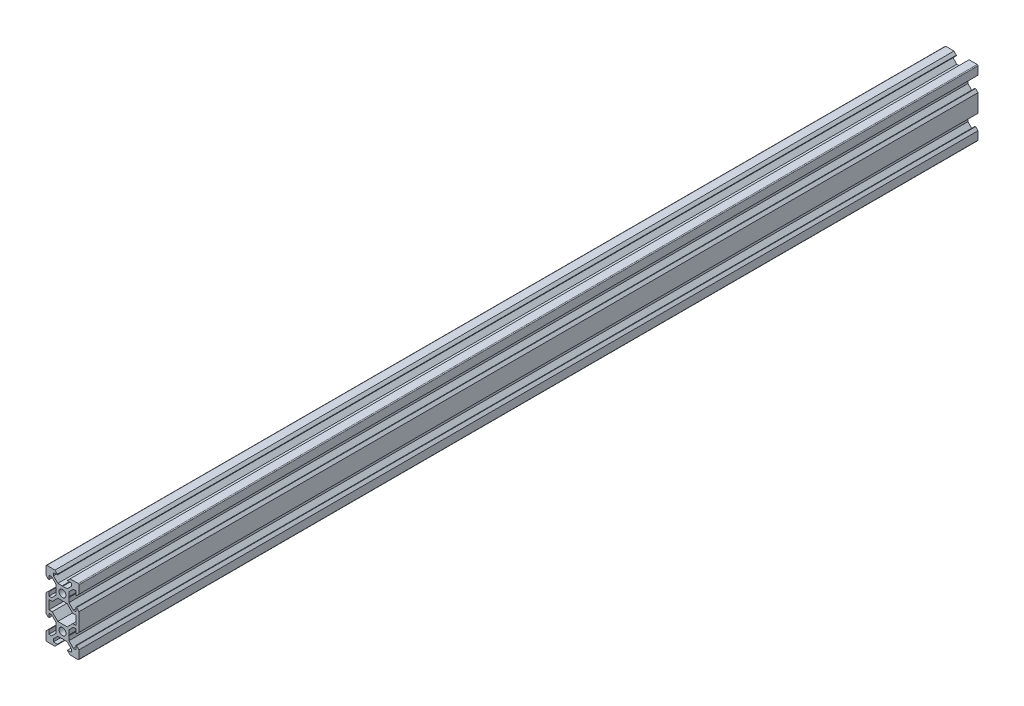
from build123d import *

# Parameters (mm, degrees)
SKETCH1_R           = 2.1
BOSS_EXTRUDE1_DEPTH = 545


with BuildPart() as part:
    # Sketch1 → Boss-Extrude1 (new body)
    with BuildSketch(Plane.XY):
        with BuildLine():
            Line((4.58, -20), (9.5, -20))
            ThreePointArc((9.5, -20), (9.853553391, -19.853553391), (10, -19.5))
            Line((10, -19.5), (10, -14.58))
            Line((10, -14.58), (8.545, -13.125))
            Line((8.545, -13.125), (8.2, -13.125))
            Line((8.2, -13.125), (8.2, -15.5))
            Line((8.2, -15.5), (6.560660172, -15.5))
            Line((6.560660172, -15.5), (3.9, -12.839339828))
            Line((3.9, -12.839339828), (3.9, -10.21))
            Line((3.9, -10.21), (3.69, -10))
            Line((3.69, -10), (3.9, -9.79))
            Line((3.9, -9.79), (3.9, -7.160660172))
            Line((3.9, -7.160660172), (6.560660172, -4.5))
            Line((6.560660172, -4.5), (8.2, -4.5))
            Line((8.2, -4.5), (8.2, -6.875))
            Line((8.2, -6.875), (8.545, -6.875))
            Line((8.545, -6.875), (10, -5.42))
            Line((10, -5.42), (10, 5.42))
            Line((10, 5.42), (8.545, 6.875))
            Line((8.545, 6.875), (8.2, 6.875))
            Line((8.2, 6.875), (8.2, 4.5))
            Line((8.2, 4.5), (6.560660172, 4.5))
            Line((6.560660172, 4.5), (3.9, 7.160660172))
            Line((3.9, 7.160660172), (3.9, 9.79))
            Line((3.9, 9.79), (3.69, 10))
            Line((3.69, 10), (3.9, 10.21))
            Line((3.9, 10.21), (3.9, 12.839339828))
            Line((3.9, 12.839339828), (6.560660172, 15.5))
            Line((6.560660172, 15.5), (8.2, 15.5))
            Line((8.2, 15.5), (8.2, 13.125))
            Line((8.2, 13.125), (8.545, 13.125))
            Line((8.545, 13.125), (10, 14.58))
            Line((10, 14.58), (10, 19.5))
            ThreePointArc((10, 19.5), (9.853553391, 19.853553391), (9.5, 20))
            Line((9.5, 20), (4.58, 20))
            Line((4.58, 20), (3.125, 18.545))
            Line((3.125, 18.545), (3.125, 18.2))
            Line((3.125, 18.2), (5.5, 18.2))
            Line((5.5, 18.2), (5.5, 16.560660172))
            Line((5.5, 16.560660172), (2.839339828, 13.9))
            Line((2.839339828, 13.9), (0.21, 13.9))
            Line((0.21, 13.9), (0, 13.69))
            Line((0, 13.69), (-0.21, 13.9))
            Line((-0.21, 13.9), (-2.839339828, 13.9))
            Line((-2.839339828, 13.9), (-5.5, 16.560660172))
            Line((-5.5, 16.560660172), (-5.5, 18.2))
            Line((-5.5, 18.2), (-3.125, 18.2))
            Line((-3.125, 18.2), (-3.125, 18.545))
            Line((-3.125, 18.545), (-4.58, 20))
            Line((-4.58, 20), (-9.5, 20))
            ThreePointArc((-9.5, 20), (-9.853553391, 19.853553391), (-10, 19.5))
            Line((-10, 19.5), (-10, 14.58))
            Line((-10, 14.58), (-8.545, 13.125))
            Line((-8.545, 13.125), (-8.2, 13.125))
            Line((-8.2, 13.125), (-8.2, 15.5))
            Line((-8.2, 15.5), (-6.560660172, 15.5))
            Line((-6.560660172, 15.5), (-3.9, 12.839339828))
            Line((-3.9, 12.839339828), (-3.9, 10.21))
            Line((-3.9, 10.21), (-3.69, 10))
            Line((-3.69, 10), (-3.9, 9.79))
            Line((-3.9, 9.79), (-3.9, 7.160660172))
            Line((-3.9, 7.160660172), (-6.560660172, 4.5))
            Line((-6.560660172, 4.5), (-8.2, 4.5))
            Line((-8.2, 4.5), (-8.2, 6.875))
            Line((-8.2, 6.875), (-8.545, 6.875))
            Line((-8.545, 6.875), (-10, 5.42))
            Line((-10, 5.42), (-10, -5.42))
            Line((-10, -5.42), (-8.545, -6.875))
            Line((-8.545, -6.875), (-8.2, -6.875))
            Line((-8.2, -6.875), (-8.2, -4.5))
            Line((-8.2, -4.5), (-6.560660172, -4.5))
            Line((-6.560660172, -4.5), (-3.9, -7.160660172))
            Line((-3.9, -7.160660172), (-3.9, -9.79))
            Line((-3.9, -9.79), (-3.69, -10))
            Line((-3.69, -10), (-3.9, -10.21))
            Line((-3.9, -10.21), (-3.9, -12.839339828))
            Line((-3.9, -12.839339828), (-6.560660172, -15.5))
            Line((-6.560660172, -15.5), (-8.2, -15.5))
            Line((-8.2, -15.5), (-8.2, -13.125))
            Line((-8.2, -13.125), (-8.545, -13.125))
            Line((-8.545, -13.125), (-10, -14.58))
            Line((-10, -14.58), (-10, -19.5))
            ThreePointArc((-10, -19.5), (-9.853553391, -19.853553391), (-9.5, -20))
            Line((-9.5, -20), (-4.58, -20))
            Line((-4.58, -20), (-3.125, -18.545))
            Line((-3.125, -18.545), (-3.125, -18.2))
            Line((-3.125, -18.2), (-5.5, -18.2))
            Line((-5.5, -18.2), (-5.5, -16.560660172))
            Line((-5.5, -16.560660172), (-2.839339828, -13.9))
            Line((-2.839339828, -13.9), (-0.21, -13.9))
            Line((-0.21, -13.9), (0, -13.69))
            Line((0, -13.69), (0.21, -13.9))
            Line((0.21, -13.9), (2.839339828, -13.9))
            Line((2.839339828, -13.9), (5.5, -16.560660172))
            Line((5.5, -16.560660172), (5.5, -18.2))
            Line((5.5, -18.2), (3.125, -18.2))
            Line((3.125, -18.2), (3.125, -18.545))
            Line((3.125, -18.545), (4.58, -20))
        make_face()
        with Locations((0, -10)):
            Circle(SKETCH1_R, mode=Mode.SUBTRACT)
        Polygon((-6.239339828, -2.7), (-8.2, -2.7), (-8.2, 2.7), (-6.239339828, 2.7), (-2.839339828, 6.1), (2.839339828, 6.1), (6.239339828, 2.7), (8.2, 2.7), (8.2, -2.7), (6.239339828, -2.7), (2.839339828, -6.1), (-2.839339828, -6.1), align=None, mode=Mode.SUBTRACT)
        with Locations((0, 10)):
            Circle(SKETCH1_R, mode=Mode.SUBTRACT)
    extrude(amount=BOSS_EXTRUDE1_DEPTH)


solid = part.part
